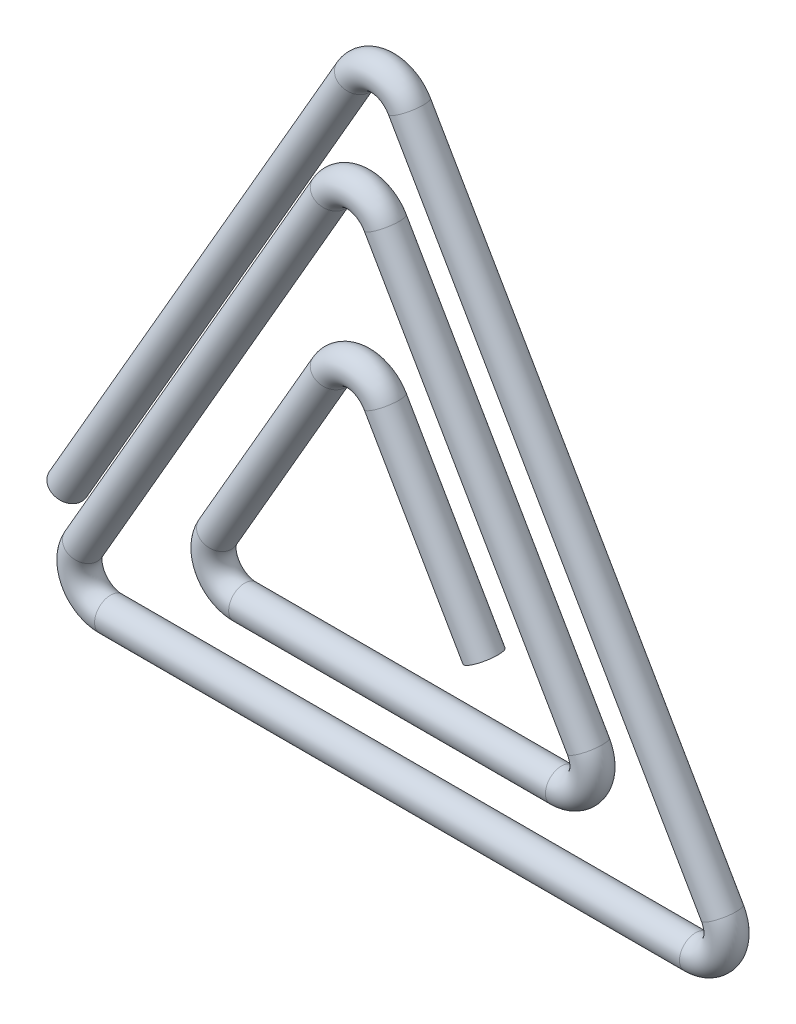
from build123d import *

# Parameters (mm, degrees)
SKETCH_3_R = 1.65


with BuildPart() as part:
    # По траектории1: sweep along a path in Эскиз2
    with BuildLine(Plane.XY) as sweep_1_path:
        Line((13, -2.516660498), (2.785699852, 15.175026322))
        ThreePointArc((2.785699852, 15.175026322), (0, 16.783350881), (-2.785699852, 15.175026322))
        Line((-2.785699852, 15.175026322), (-14.534808224, -5.175026322))
        ThreePointArc((-14.534808224, -5.175026322), (-14.534808224, -8.391675441), (-11.749108372, -10))
        Line((-11.749108372, -10), (20.986712679, -10))
        ThreePointArc((20.986712679, -10), (23.772412531, -8.391675441), (23.772412531, -5.175026322))
        Line((23.772412531, -5.175026322), (2.785699852, 31.175026322))
        ThreePointArc((2.785699852, 31.175026322), (0, 32.783350881), (-2.785699852, 31.175026322))
        Line((-2.785699852, 31.175026322), (-28.391214684, -13.175026322))
        ThreePointArc((-28.391214684, -13.175026322), (-28.391214684, -16.391675441), (-25.605514832, -18))
        Line((-25.605514832, -18), (34.843119139, -18))
        ThreePointArc((34.843119139, -18), (37.628818991, -16.391675441), (37.628818991, -13.175026322))
        Line((37.628818991, -13.175026322), (5.285699852, 42.844899303))
        ThreePointArc((5.285699852, 42.844899303), (2.5, 44.453223862), (-0.285699852, 42.844899303))
        Line((-0.285699852, 42.844899303), (-30, -8.621778265))
    # Эскиз3 → По траектории1 (sweep)
    with BuildSketch(Plane(origin=(13, -2.516660498, 0), x_dir=(-0.8660254037844386, -0.5000000000000001, 0), z_dir=(0.5000000000000001, -0.8660254037844386, 0))):
        Circle(SKETCH_3_R)
    sweep(path=sweep_1_path.line)


solid = part.part
